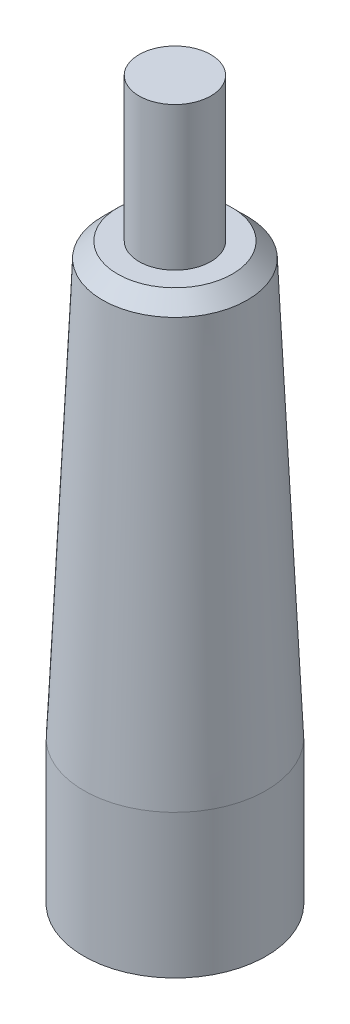
from build123d import *

# Parameters (mm, degrees)
CHAMFER3_SIZE  = 0.5
CHAMFER3_SIZE2 = 0.524090046


with BuildPart() as part:
    # Sketch4 → Revolve1 (revolve)
    with BuildSketch(Plane.XY, mode=Mode.PRIVATE) as revolve1_sk:
        Polygon((0, 0), (0, 20), (0, 25), (1.25, 25), (1.25, 20), (2.5, 20), (3.175, 5), (3.175, 0), align=None)
    revolve(revolve1_sk.sketch.rotate(Axis((0, 0, 0), (0, 1, 0)), 90), axis=Axis((0, 0, 0), (0, 1, 0)))

    # Chamfer3
    chamfer3_edges = [part.edges().sort_by_distance(p)[0] for p in [
        (0, 20, 2.5),
    ]]
    chamfer3_side = [part.faces().sort_by_distance(p)[0] for p in [
        (0, 20, 1.320710678),
    ]]
    chamfer(chamfer3_edges, length=CHAMFER3_SIZE, length2=CHAMFER3_SIZE2, reference=chamfer3_side[0])


solid = part.part
